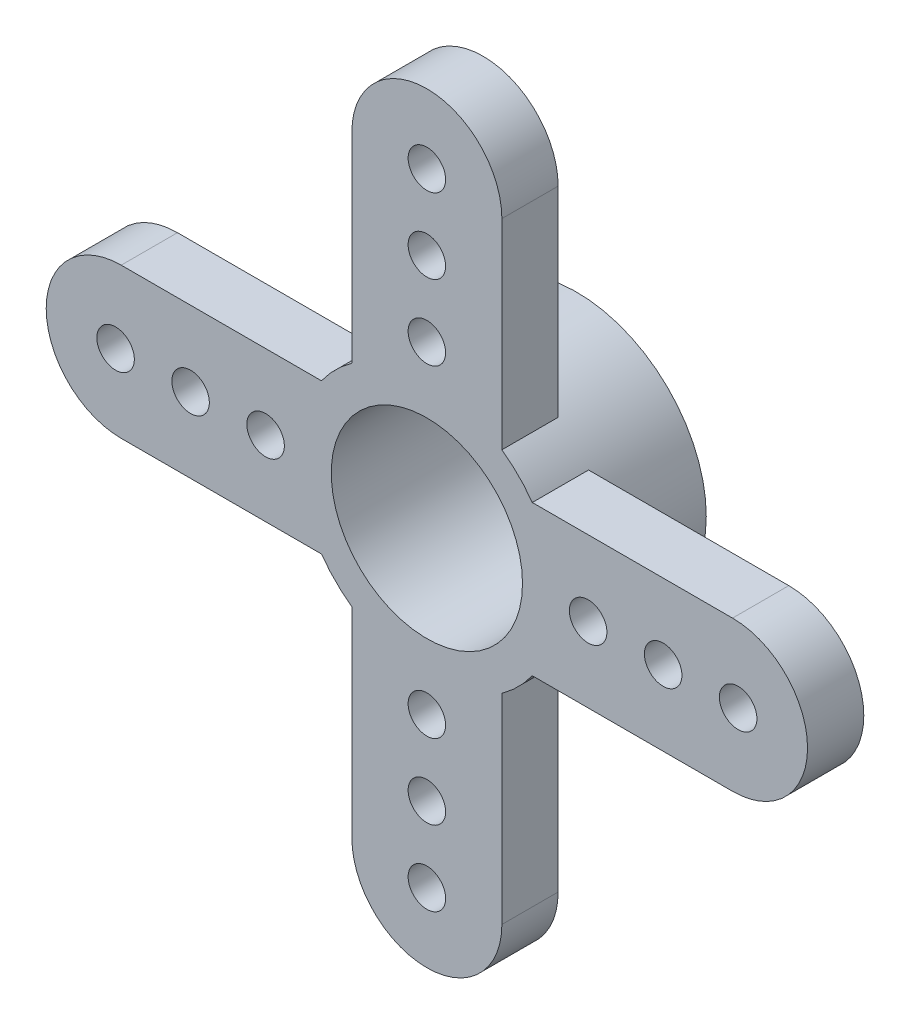
from build123d import *

# Parameters (mm, degrees)
COMPACT_HORN_CENTER_OD6P9_PROFILE_R        = 3.45
COMPACT_HORN_CENTER_OD6P9_DEPTH            = 1.5
HORIZONTAL_BLADES_ASSUMED_WIDTH4_PROFILE_W = 16.3
HORIZONTAL_BLADES_ASSUMED_WIDTH4_PROFILE_H = 4
HORIZONTAL_BLADES_ASSUMED_WIDTH4_DEPTH     = 1.5
VERTICAL_BLADES_ASSUMED_WIDTH4_PROFILE_W   = 4
VERTICAL_BLADES_ASSUMED_WIDTH4_PROFILE_H   = 16.3
VERTICAL_BLADES_ASSUMED_WIDTH4_DEPTH       = 1.5
ROUNDED_BLADE_TIPS_R                       = 2
ROUNDED_TIPS_SPAN20P3_DEPTH                = 1.5
HUB_PROJECTION2P5_TOTAL_HEIGHT4_START      = -2.5
HUB_PROJECTION2P5_TOTAL_HEIGHT4_PROFILE_R  = 3.45
HUB_PROJECTION2P5_TOTAL_HEIGHT4_DEPTH      = 2.5
PURCHASED_SPLINE_INTERNALS_OMITTED_START   = -50
PURCHASED_SPLINE_INTERNALS_OMITTED_PROFI_R = 2.55
PURCHASED_SPLINE_INTERNALS_OMITTED_DEPTH   = 65.570346598
UNMODIFIED_STOCK_PILOT_HOLES_START         = -50
UNMODIFIED_STOCK_PILOT_HOLES_PROFILE_R     = 0.5
UNMODIFIED_STOCK_PILOT_HOLES_DEPTH         = 65.570346598


with BuildPart() as part:
    # Compact_horn_center_OD6p9_profile → Compact_horn_center_OD6p9 (new body)
    with BuildSketch(Plane.XY):
        Circle(COMPACT_HORN_CENTER_OD6P9_PROFILE_R)
    extrude(amount=COMPACT_HORN_CENTER_OD6P9_DEPTH)

    # Horizontal_blades_assumed_width4_profile → Horizontal_blades_assumed_width4 (add)
    with BuildSketch(Plane.XY):
        Rectangle(HORIZONTAL_BLADES_ASSUMED_WIDTH4_PROFILE_W, HORIZONTAL_BLADES_ASSUMED_WIDTH4_PROFILE_H)
    extrude(amount=HORIZONTAL_BLADES_ASSUMED_WIDTH4_DEPTH)

    # Vertical_blades_assumed_width4_profile → Vertical_blades_assumed_width4 (add)
    with BuildSketch(Plane.XY):
        Rectangle(VERTICAL_BLADES_ASSUMED_WIDTH4_PROFILE_W, VERTICAL_BLADES_ASSUMED_WIDTH4_PROFILE_H)
    extrude(amount=VERTICAL_BLADES_ASSUMED_WIDTH4_DEPTH)

    # Rounded_blade_tips → Rounded_tips_span20p3 (add)
    with BuildSketch(Plane.XY):
        with Locations((8.15, 0)):
            Circle(ROUNDED_BLADE_TIPS_R)
        with Locations((-8.15, 0)):
            Circle(ROUNDED_BLADE_TIPS_R)
        with Locations((0, 8.15)):
            Circle(ROUNDED_BLADE_TIPS_R)
        with Locations((0, -8.15)):
            Circle(ROUNDED_BLADE_TIPS_R)
    extrude(amount=ROUNDED_TIPS_SPAN20P3_DEPTH)

    # Hub_projection2p5_total_height4_profile → Hub_projection2p5_total_height4 (add)
    with BuildSketch(Plane.XY.offset(HUB_PROJECTION2P5_TOTAL_HEIGHT4_START)):
        with Locations(Location((0, 0, 0), (0, 0, 215.43015836))):
            Circle(HUB_PROJECTION2P5_TOTAL_HEIGHT4_PROFILE_R)
    extrude(amount=HUB_PROJECTION2P5_TOTAL_HEIGHT4_DEPTH)

    # Purchased_spline_internals_omitted_profile → Purchased_spline_internals_omitted (cut, through all)
    with BuildSketch(Plane.XY.offset(PURCHASED_SPLINE_INTERNALS_OMITTED_START)):
        Circle(PURCHASED_SPLINE_INTERNALS_OMITTED_PROFI_R)
    extrude(amount=PURCHASED_SPLINE_INTERNALS_OMITTED_DEPTH, mode=Mode.SUBTRACT)

    # Unmodified_stock_pilot_holes_profile → Unmodified_stock_pilot_holes (cut, through all)
    with BuildSketch(Plane.XY.offset(UNMODIFIED_STOCK_PILOT_HOLES_START)):
        with Locations((-8.3, 0)):
            Circle(UNMODIFIED_STOCK_PILOT_HOLES_PROFILE_R)
        with Locations((-6.3, 0)):
            Circle(UNMODIFIED_STOCK_PILOT_HOLES_PROFILE_R)
        with Locations((-4.3, 0)):
            Circle(UNMODIFIED_STOCK_PILOT_HOLES_PROFILE_R)
        with Locations((4.3, 0)):
            Circle(UNMODIFIED_STOCK_PILOT_HOLES_PROFILE_R)
        with Locations((6.3, 0)):
            Circle(UNMODIFIED_STOCK_PILOT_HOLES_PROFILE_R)
        with Locations((8.3, 0)):
            Circle(UNMODIFIED_STOCK_PILOT_HOLES_PROFILE_R)
        with Locations((0, -8.3)):
            Circle(UNMODIFIED_STOCK_PILOT_HOLES_PROFILE_R)
        with Locations((0, -6.3)):
            Circle(UNMODIFIED_STOCK_PILOT_HOLES_PROFILE_R)
        with Locations((0, -4.3)):
            Circle(UNMODIFIED_STOCK_PILOT_HOLES_PROFILE_R)
        with Locations((0, 4.3)):
            Circle(UNMODIFIED_STOCK_PILOT_HOLES_PROFILE_R)
        with Locations((0, 6.3)):
            Circle(UNMODIFIED_STOCK_PILOT_HOLES_PROFILE_R)
        with Locations((0, 8.3)):
            Circle(UNMODIFIED_STOCK_PILOT_HOLES_PROFILE_R)
    extrude(amount=UNMODIFIED_STOCK_PILOT_HOLES_DEPTH, mode=Mode.SUBTRACT)


solid = part.part
